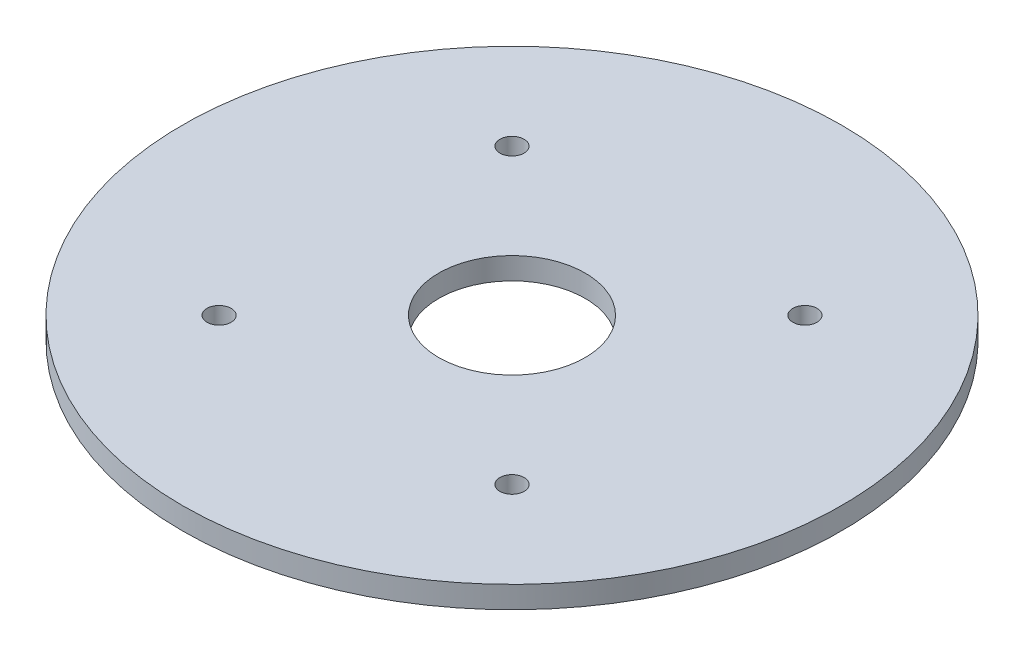
from build123d import *

# Parameters (mm, degrees)
SKETCH1_R           = 45
SKETCH1_R_2         = 10
BOSS_EXTRUDE1_DEPTH = 1.5
SKETCH2_R           = 1.65
CUT_EXTRUDE1_DEPTH  = 10


with BuildPart() as part:
    # Sketch1 → Boss-Extrude1 (new, symmetric)
    with BuildSketch(Plane(origin=(0, 0, 0), x_dir=(1, 0, 0), z_dir=(0, 1, 0))):
        with Locations(Location((0, 0, 0), (0, 0, 270))):
            Circle(SKETCH1_R)
        with Locations(Location((0, 0, 0), (0, 0, 270))):
            Circle(SKETCH1_R_2, mode=Mode.SUBTRACT)
    extrude(amount=BOSS_EXTRUDE1_DEPTH, both=True)

    # Sketch2 → Cut-Extrude1 (cut)
    with BuildSketch(Plane(origin=(0, 1.5, 0), x_dir=(1, 0, 0), z_dir=(0, 1, 0))):
        with Locations(Location((-20, -20, 0), (0, 0, 270))):
            Circle(SKETCH2_R)
        with Locations(Location((-20, 20, 0), (0, 0, 270))):
            Circle(SKETCH2_R)
        with Locations(Location((20, 20, 0), (0, 0, 270))):
            Circle(SKETCH2_R)
        with Locations(Location((20, -20, 0), (0, 0, 270))):
            Circle(SKETCH2_R)
    extrude(amount=-CUT_EXTRUDE1_DEPTH, mode=Mode.SUBTRACT)


solid = part.part
